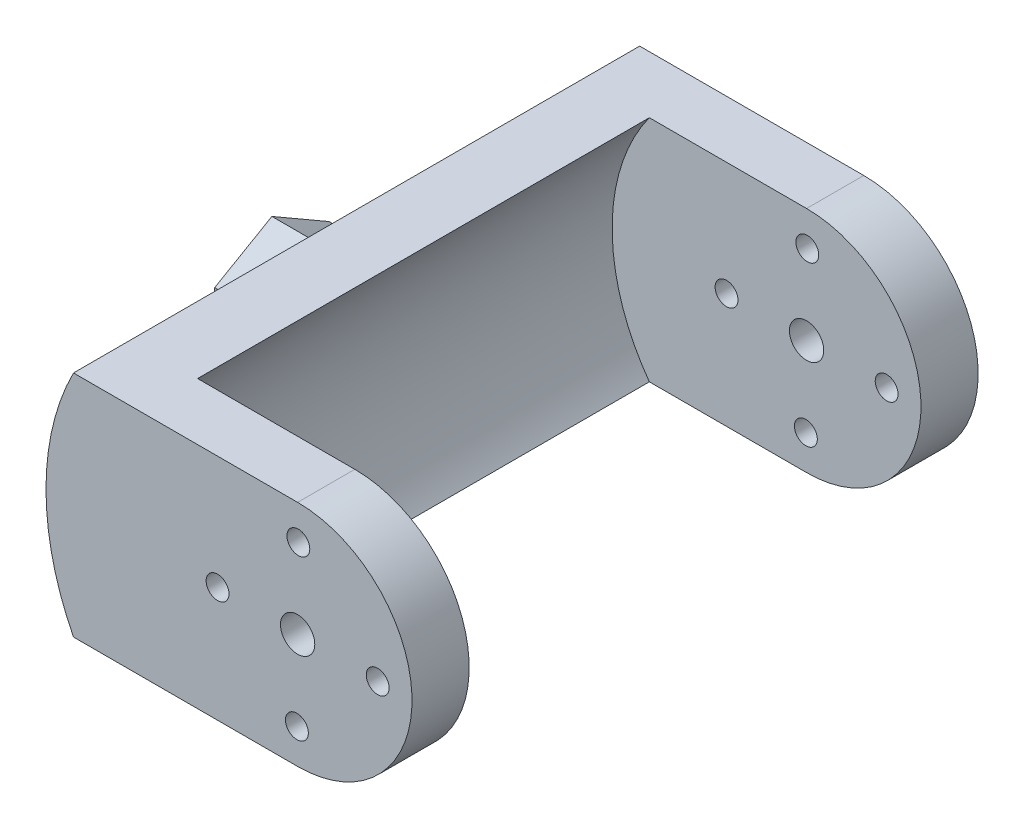
from build123d import *

# Parameters (mm, degrees)
ESQUISSE1_R             = 1
ESQUISSE1_R_2           = 1.5
BOSS_EXTRU_1_DEPTH      = 5
ENL_V_MAT_EXTRU_1_DEPTH = 5
ESQUISSE3_W             = 20
ESQUISSE3_H             = 34
BOSS_EXTRU_2_DEPTH      = 5
ESQUISSE4_R             = 1.5
ESQUISSE4_W             = 9.798464728
ESQUISSE4_H             = 39.858161606
ENL_V_MAT_EXTRU_2_DEPTH = 5
ESQUISSE5_W             = 2.5
ESQUISSE5_H             = 34
BOSS_EXTRU_3_DEPTH      = 5
ESQUISSE6_R             = 1.6
BOSS_EXTRU_4_DEPTH      = 5
ESQUISSE7_W             = 28.704476199
ESQUISSE7_H             = 52.959758587
ENL_V_MAT_EXTRU_3_DEPTH = 10
ESQUISSE8_R             = 1
ESQUISSE8_R_2           = 1.5
BOSS_EXTRU_5_DEPTH      = 5
BOSS_EXTRU_6_DEPTH      = 49.5
BOSS_EXTRU_7_DEPTH      = 1
BOSS_EXTRU_7_DEPTH_BACK = 5


with BuildPart() as part:
    # Esquisse1 → Boss.-Extru.1 (new body)
    with BuildSketch(Plane.XY):
        with BuildLine():
            Line((-13.584596858, -30.047129187), (-13.584596858, -25.547129187))
            Line((-13.584596858, -25.547129187), (-13.584596858, -25.297129187))
            Line((-13.584596858, -25.297129187), (-13.834596858, -25.297129187))
            Line((-13.834596858, -25.297129187), (-16.334596858, -25.297129187))
            Line((-16.334596858, -25.297129187), (-16.584596858, -25.297129187))
            Line((-16.584596858, -25.297129187), (-16.584596858, -25.047129187))
            Line((-16.584596858, -25.047129187), (-16.584596858, 6.452870813))
            Line((-16.584596858, 6.452870813), (-16.584596858, 6.702870813))
            Line((-16.584596858, 6.702870813), (-16.334596858, 6.702870813))
            Line((-16.334596858, 6.702870813), (-13.834596858, 6.702870813))
            Line((-13.834596858, 6.702870813), (-13.584596858, 6.702870813))
            Line((-13.584596858, 6.702870813), (-13.584596858, 6.952870813))
            Line((-13.584596858, 6.952870813), (-13.584596858, 11.452870813))
            Line((-13.584596858, 11.452870813), (-13.584596858, 11.702870813))
            Line((-13.584596858, 11.702870813), (-13.334596858, 11.702870813))
            Line((-13.334596858, 11.702870813), (-8.584596858, 11.702870813))
            Line((-8.584596858, 11.702870813), (-8.584596858, 6.702870813))
            Line((-8.584596858, 6.702870813), (-7.491776281, 6.702870813))
            Line((-7.491776281, 6.702870813), (-4.034541178, 6.702870813))
            ThreePointArc((-4.034541178, 6.702870813), (-0.161557832, 6.19424756), (3.448773595, 4.702870813))
            ThreePointArc((3.448773595, 4.702870813), (10.66943645, 1.720117321), (18.415403142, 0.702870813))
            ThreePointArc((18.415403142, 0.702870813), (28.415403142, -9.297129187), (18.415403142, -19.297129187))
            ThreePointArc((18.415403142, -19.297129187), (10.66943645, -20.314375694), (3.448773595, -23.297129187))
            ThreePointArc((3.448773595, -23.297129187), (-0.161557832, -24.788505933), (-4.034541178, -25.297129187))
            Line((-4.034541178, -25.297129187), (-7.491776281, -25.297129187))
            Line((-7.491776281, -25.297129187), (-8.584596858, -25.297129187))
            Line((-8.584596858, -25.297129187), (-8.584596858, -30.297129187))
            Line((-8.584596858, -30.297129187), (-13.334596858, -30.297129187))
            Line((-13.334596858, -30.297129187), (-13.584596858, -30.297129187))
            Line((-13.584596858, -30.297129187), (-13.584596858, -30.047129187))
        make_face()
        with Locations((18.477857718, -2.297129187)):
            Circle(ESQUISSE1_R, mode=Mode.SUBTRACT)
        with Locations((25.415403142, -9.359583762)):
            Circle(ESQUISSE1_R, mode=Mode.SUBTRACT)
        with Locations((18.415403142, -9.297129187)):
            Circle(ESQUISSE1_R_2, mode=Mode.SUBTRACT)
        with Locations((11.415403142, -9.234674611)):
            Circle(ESQUISSE1_R, mode=Mode.SUBTRACT)
        with Locations((18.352948567, -16.297129187)):
            Circle(ESQUISSE1_R, mode=Mode.SUBTRACT)
    extrude(amount=BOSS_EXTRU_1_DEPTH)

    # Esquisse2 → Enlèv. mat.-Extru.1 (cut)
    with BuildSketch(Plane(origin=(0, 0, 0), x_dir=(-1, 0, 0), z_dir=(0, 0, -1))):
        Polygon((1.584596858, -19.297129187), (1.584596858, -25.297129187), (1.584596858, -26.297129187), (21.584596858, -26.297129187), (21.584596858, -33.65697819), (-26.833247513, -33.65697819), (-26.198667142, -19.297129187), align=None)
        Polygon((21.584596858, 7.702870813), (1.584596858, 7.702870813), (1.584596858, 6.702870813), (1.584596858, 0.702870813), (-26.198667142, 0.702870813), (-26.833247513, 15.062719816), (21.584596858, 15.062719816), align=None)
    extrude(amount=-ENL_V_MAT_EXTRU_1_DEPTH, mode=Mode.SUBTRACT)

    # Esquisse3 → Boss.-Extru.2 (add)
    with BuildSketch(Plane(origin=(0, 0, 0), x_dir=(-1, 0, 0), z_dir=(0, 0, -1))):
        with Locations((11.584596858, -9.297129187)):
            Rectangle(ESQUISSE3_W, ESQUISSE3_H)
    extrude(amount=-BOSS_EXTRU_2_DEPTH)

    # Esquisse4 → Enlèv. mat.-Extru.2 (cut)
    with BuildSketch(Plane(origin=(0, 0, 0), x_dir=(-1, 0, 0), z_dir=(0, 0, -1))):
        with Locations((9.084596858, -22.797129187)):
            Circle(ESQUISSE4_R)
        with Locations((9.084596858, 4.202870813)):
            Circle(ESQUISSE4_R)
        with Locations((23.983829222, -9.020336398)):
            Rectangle(ESQUISSE4_W, ESQUISSE4_H)
    extrude(amount=-ENL_V_MAT_EXTRU_2_DEPTH, mode=Mode.SUBTRACT)

    # Esquisse5 → Boss.-Extru.3 (add)
    with BuildSketch(Plane(origin=(0, 0, 0), x_dir=(-1, 0, 0), z_dir=(0, 0, -1))):
        with Locations((0.334596858, -9.297129187)):
            Rectangle(ESQUISSE5_W, ESQUISSE5_H)
    extrude(amount=-BOSS_EXTRU_3_DEPTH)

    # Esquisse6 → Boss.-Extru.4 (add)
    # profile 1 of 2: a face of its own
    with BuildSketch(Plane(origin=(0, 0, 0), x_dir=(-1, 0, 0), z_dir=(0, 0, -1))):
        with BuildLine():
            Line((12.324596858, -25.12480516), (5.844596858, -25.12480516))
            Line((5.844596858, -25.12480516), (5.844596858, -28.797129187))
            ThreePointArc((5.844596858, -28.797129187), (9.084596858, -32.037129187), (12.324596858, -28.797129187))
            Line((12.324596858, -28.797129187), (12.324596858, -25.12480516))
        make_face()
        with Locations((9.084596858, -28.797129187)):
            Circle(ESQUISSE6_R, mode=Mode.SUBTRACT)
    # profile 2 of 2: a face of its own
    with BuildSketch(Plane(origin=(0, 0, 0), x_dir=(-1, 0, 0), z_dir=(0, 0, -1))):
        with BuildLine():
            Line((12.324596858, 6.757738308), (5.844596858, 6.757738308))
            Line((5.844596858, 6.757738308), (5.844596858, 10.202870813))
            ThreePointArc((5.844596858, 10.202870813), (9.084596858, 13.442870813), (12.324596858, 10.202870813))
            Line((12.324596858, 10.202870813), (12.324596858, 6.757738308))
        make_face()
        with Locations((9.084596858, 10.202870813)):
            Circle(ESQUISSE6_R, mode=Mode.SUBTRACT)
    extrude(amount=-BOSS_EXTRU_4_DEPTH)

    # Esquisse7 → Enlèv. mat.-Extru.3 (cut)
    with BuildSketch(Plane.XY.offset(5)):
        with Locations((-12.936834958, -9.72769633)):
            Rectangle(ESQUISSE7_W, ESQUISSE7_H)
    extrude(amount=-ENL_V_MAT_EXTRU_3_DEPTH, mode=Mode.SUBTRACT)



with BuildPart() as body_2:
    # Esquisse8 → Boss.-Extru.5 (new body)
    with BuildSketch(Plane(origin=(0, 0, -39.5), x_dir=(-1, 0, 0), z_dir=(0, 0, -1))):
        with BuildLine():
            Line((-18.415403142, -19.297129187), (-1.415403142, -19.297129187))
            Line((-1.415403142, -19.297129187), (-1.415403142, 0.702870813))
            Line((-1.415403142, 0.702870813), (-18.415403142, 0.702870813))
            ThreePointArc((-18.415403142, 0.702870813), (-28.415403142, -9.297129187), (-18.415403142, -19.297129187))
        make_face()
        with Locations(Location((-11.415403142, -9.234674611, 0), (0, 0, 180))):
            Circle(ESQUISSE8_R, mode=Mode.SUBTRACT)
        with Locations(Location((-18.352948567, -16.297129187, 0), (0, 0, 180))):
            Circle(ESQUISSE8_R, mode=Mode.SUBTRACT)
        with Locations(Location((-18.415403142, -9.297129187, 0), (0, 0, 180))):
            Circle(ESQUISSE8_R_2, mode=Mode.SUBTRACT)
        with Locations(Location((-18.477857718, -2.297129187, 0), (0, 0, 180))):
            Circle(ESQUISSE8_R, mode=Mode.SUBTRACT)
        with Locations(Location((-25.415403142, -9.359583762, 0), (0, 0, 180))):
            Circle(ESQUISSE8_R, mode=Mode.SUBTRACT)
    extrude(amount=BOSS_EXTRU_5_DEPTH)


with BuildPart() as part_1:
    add(part.part)

    add(body_2.part)  # Boss.-Extru.6 merges body 2
    # Esquisse9 → Boss.-Extru.6 (add)
    with BuildSketch(Plane.XY.offset(5)):
        with BuildLine():
            Line((4.667676058, -19.297129187), (-1.1805148, -19.297129187))
            ThreePointArc((-1.1805148, -19.297129187), (-3.584596858, -9.297129187), (-1.1805148, 0.702870813))
            Line((-1.1805148, 0.702870813), (4.667676058, 0.702870813))
            ThreePointArc((4.667676058, 0.702870813), (1.415403142, -9.297129187), (4.667676058, -19.297129187))
        make_face()
    extrude(amount=-BOSS_EXTRU_6_DEPTH)

    # Esquisse10 → Boss.-Extru.7 (add, two sides: drawn at the far end of the back side and taken through both)
    with BuildSketch(Plane(origin=(-3.584596858, 0, 0), x_dir=(0, 0, -1), z_dir=(1, 0, 0)).offset(-BOSS_EXTRU_7_DEPTH_BACK)):
        Polygon((24.75, -12.183880533), (24.75, -6.410377841), (19.75, -3.523626495), (14.75, -6.410377841), (14.75, -12.183880533), (19.75, -15.070631878), align=None)
    extrude(amount=BOSS_EXTRU_7_DEPTH + BOSS_EXTRU_7_DEPTH_BACK)


solid = part_1.part
